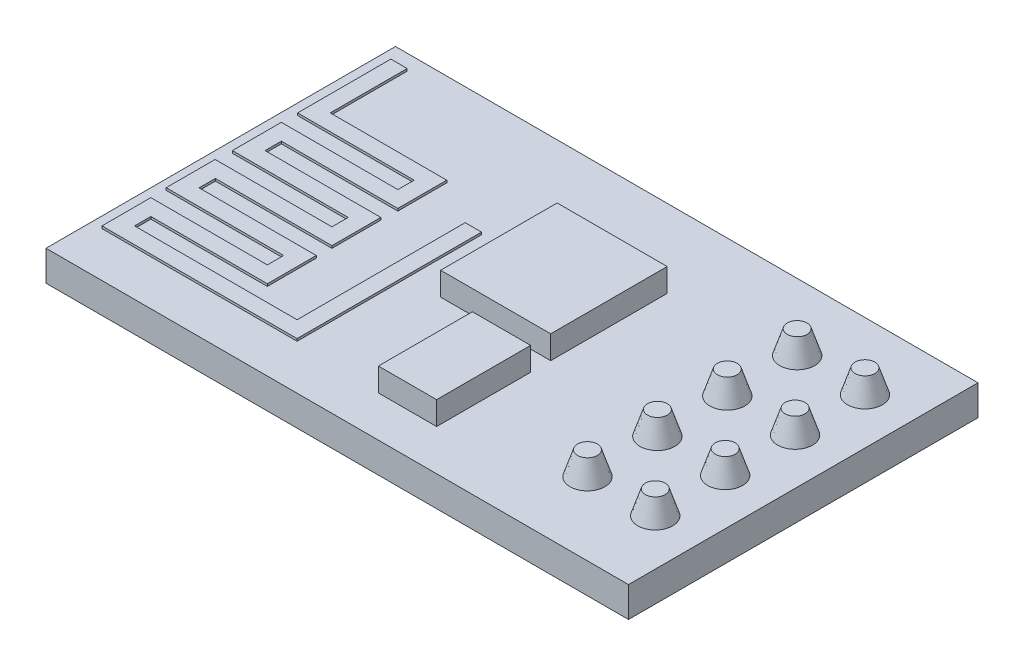
from build123d import *

# Parameters (mm, degrees)
SKETCH1_W                     = 25
SKETCH1_H                     = 15
BOSS_EXTRUDE1_DEPTH           = 1.3
BOSS_EXTRUDE2_DEPTH           = 0.1
SKETCH3_W                     = 4.723765288
SKETCH3_H                     = 5
SKETCH3_W_2                   = 2.5
SKETCH3_H_2                   = 4.03488285
BOSS_EXTRUDE3_DEPTH           = 1
SKETCH4_R                     = 0.75
BOSS_EXTRUDE4_DEPTH           = 1
BOSS_EXTRUDE4_DRAFT           = 18
BOSS_EXTRUDE4_PROFILE_2_DEPTH = 1
BOSS_EXTRUDE4_PROFILE_2_DRAFT = 18
BOSS_EXTRUDE4_PROFILE_3_DEPTH = 1
BOSS_EXTRUDE4_PROFILE_3_DRAFT = 18
BOSS_EXTRUDE4_PROFILE_4_DEPTH = 1
BOSS_EXTRUDE4_PROFILE_4_DRAFT = 18
BOSS_EXTRUDE4_PROFILE_5_DEPTH = 1
BOSS_EXTRUDE4_PROFILE_5_DRAFT = 18
BOSS_EXTRUDE4_PROFILE_6_DEPTH = 1
BOSS_EXTRUDE4_PROFILE_6_DRAFT = 18
BOSS_EXTRUDE4_PROFILE_7_DEPTH = 1
BOSS_EXTRUDE4_PROFILE_7_DRAFT = 18
BOSS_EXTRUDE4_PROFILE_8_DEPTH = 1
BOSS_EXTRUDE4_PROFILE_8_DRAFT = 18


with BuildPart() as part:
    # Sketch1 → Boss-Extrude1 (new body)
    with BuildSketch(Plane(origin=(0, 0, 0), x_dir=(1, 0, 0), z_dir=(0, 1, 0))):
        Rectangle(SKETCH1_W, SKETCH1_H)
    extrude(amount=BOSS_EXTRUDE1_DEPTH)

    # Sketch2 → Boss-Extrude2 (add)
    with BuildSketch(Plane(origin=(0, 1.3, 0), x_dir=(1, 0, 0), z_dir=(0, 1, 0))):
        Polygon((-3.654721125, -5.569339468), (-12.030839718, -5.569339468), (-12.030839718, -3.469339468), (-7.030839718, -3.469339468), (-7.030839718, -2.769339468), (-12.071748872, -2.769339468), (-12.071748872, -0.669339468), (-7.060469733, -0.669339468), (-7.060469733, 0.030660532), (-12.030839718, 0.030660532), (-12.030839718, 2.130660532), (-7.030839718, 2.130660532), (-7.030839718, 2.830660532), (-12.030839718, 2.830660532), (-12.030839718, 6.830660532), (-11.330839718, 6.830660532), (-11.330839718, 3.530660532), (-6.330839718, 3.530660532), (-6.330839718, 1.430660532), (-11.330839718, 1.430660532), (-11.330839718, 0.730660532), (-6.360469733, 0.730660532), (-6.360469733, -1.369339468), (-11.360469733, -1.369339468), (-11.360469733, -2.069339468), (-6.330839718, -2.069339468), (-6.330839718, -4.169339468), (-11.330839718, -4.169339468), (-11.330839718, -4.869339468), (-4.354721125, -4.869339468), (-4.354721125, 2.346150012), (-3.654721125, 2.346150012), align=None)
    extrude(amount=BOSS_EXTRUDE2_DEPTH)

    # Sketch3 → Boss-Extrude3 (add)
    with BuildSketch(Plane(origin=(0, 1.3, 0), x_dir=(1, 0, 0), z_dir=(0, 1, 0))):
        with Locations((0.147617665, 1.651198425)):
            Rectangle(SKETCH3_W, SKETCH3_H)
        with Locations((1.259500309, -3.727346048)):
            Rectangle(SKETCH3_W_2, SKETCH3_H_2)
    extrude(amount=BOSS_EXTRUDE3_DEPTH)


with BuildPart() as boss_extrude4_tool:
    # Sketch4 → Boss-Extrude4 (with draft: the straight prism first)
    with BuildSketch(Plane(origin=(0, 1.3, 0), x_dir=(1, 0, 0), z_dir=(0, 1, 0))):
        with Locations((7.608740396, 4.631238018)):
            Circle(SKETCH4_R)
    extrude(amount=BOSS_EXTRUDE4_DEPTH)
    # Boss-Extrude4: the draft: its side faces are tilted about the plane it starts from
    boss_extrude4_sides = [boss_extrude4_tool.faces().sort_by_distance(p)[0] for p in [
        (6.858740396, 1.8, -4.631238018),
    ]]
    draft(boss_extrude4_sides, Plane(origin=(0, 1.3, 0), x_dir=(1, 0, 0), z_dir=(0, 1, 0)), BOSS_EXTRUDE4_DRAFT)


with BuildPart() as part_1:
    add(part.part)

    # Boss-Extrude4: add boss_extrude4_tool
    add(boss_extrude4_tool.part)


with BuildPart() as boss_extrude4_profile_2_tool:
    # Sketch4 → Boss-Extrude4 profile 2 (with draft: the straight prism first)
    with BuildSketch(Plane(origin=(0, 1.3, 0), x_dir=(1, 0, 0), z_dir=(0, 1, 0))):
        with Locations((10.517617168, 4.631238018)):
            Circle(SKETCH4_R)
    extrude(amount=BOSS_EXTRUDE4_PROFILE_2_DEPTH)
    # Boss-Extrude4 profile 2: the draft: its side faces are tilted about the plane it starts from
    boss_extrude4_profile_2_sides = [boss_extrude4_profile_2_tool.faces().sort_by_distance(p)[0] for p in [
        (9.767617168, 1.8, -4.631238018),
    ]]
    draft(boss_extrude4_profile_2_sides, Plane(origin=(0, 1.3, 0), x_dir=(1, 0, 0), z_dir=(0, 1, 0)), BOSS_EXTRUDE4_PROFILE_2_DRAFT)


with BuildPart() as part_2:
    add(part_1.part)

    # Boss-Extrude4 profile 2: add boss_extrude4_profile_2_tool
    add(boss_extrude4_profile_2_tool.part)


with BuildPart() as boss_extrude4_profile_3_tool:
    # Sketch4 → Boss-Extrude4 profile 3 (with draft: the straight prism first)
    with BuildSketch(Plane(origin=(0, 1.3, 0), x_dir=(1, 0, 0), z_dir=(0, 1, 0))):
        with Locations((7.608740396, 1.631238018)):
            Circle(SKETCH4_R)
    extrude(amount=BOSS_EXTRUDE4_PROFILE_3_DEPTH)
    # Boss-Extrude4 profile 3: the draft: its side faces are tilted about the plane it starts from
    boss_extrude4_profile_3_sides = [boss_extrude4_profile_3_tool.faces().sort_by_distance(p)[0] for p in [
        (6.858740396, 1.8, -1.631238018),
    ]]
    draft(boss_extrude4_profile_3_sides, Plane(origin=(0, 1.3, 0), x_dir=(1, 0, 0), z_dir=(0, 1, 0)), BOSS_EXTRUDE4_PROFILE_3_DRAFT)


with BuildPart() as part_3:
    add(part_2.part)

    # Boss-Extrude4 profile 3: add boss_extrude4_profile_3_tool
    add(boss_extrude4_profile_3_tool.part)


with BuildPart() as boss_extrude4_profile_4_tool:
    # Sketch4 → Boss-Extrude4 profile 4 (with draft: the straight prism first)
    with BuildSketch(Plane(origin=(0, 1.3, 0), x_dir=(1, 0, 0), z_dir=(0, 1, 0))):
        with Locations((10.517617168, 1.631238018)):
            Circle(SKETCH4_R)
    extrude(amount=BOSS_EXTRUDE4_PROFILE_4_DEPTH)
    # Boss-Extrude4 profile 4: the draft: its side faces are tilted about the plane it starts from
    boss_extrude4_profile_4_sides = [boss_extrude4_profile_4_tool.faces().sort_by_distance(p)[0] for p in [
        (9.767617168, 1.8, -1.631238018),
    ]]
    draft(boss_extrude4_profile_4_sides, Plane(origin=(0, 1.3, 0), x_dir=(1, 0, 0), z_dir=(0, 1, 0)), BOSS_EXTRUDE4_PROFILE_4_DRAFT)


with BuildPart() as part_4:
    add(part_3.part)

    # Boss-Extrude4 profile 4: add boss_extrude4_profile_4_tool
    add(boss_extrude4_profile_4_tool.part)


with BuildPart() as boss_extrude4_profile_5_tool:
    # Sketch4 → Boss-Extrude4 profile 5 (with draft: the straight prism first)
    with BuildSketch(Plane(origin=(0, 1.3, 0), x_dir=(1, 0, 0), z_dir=(0, 1, 0))):
        with Locations((7.608740396, -1.368761982)):
            Circle(SKETCH4_R)
    extrude(amount=BOSS_EXTRUDE4_PROFILE_5_DEPTH)
    # Boss-Extrude4 profile 5: the draft: its side faces are tilted about the plane it starts from
    boss_extrude4_profile_5_sides = [boss_extrude4_profile_5_tool.faces().sort_by_distance(p)[0] for p in [
        (6.858740396, 1.8, 1.368761982),
    ]]
    draft(boss_extrude4_profile_5_sides, Plane(origin=(0, 1.3, 0), x_dir=(1, 0, 0), z_dir=(0, 1, 0)), BOSS_EXTRUDE4_PROFILE_5_DRAFT)


with BuildPart() as part_5:
    add(part_4.part)

    # Boss-Extrude4 profile 5: add boss_extrude4_profile_5_tool
    add(boss_extrude4_profile_5_tool.part)


with BuildPart() as boss_extrude4_profile_6_tool:
    # Sketch4 → Boss-Extrude4 profile 6 (with draft: the straight prism first)
    with BuildSketch(Plane(origin=(0, 1.3, 0), x_dir=(1, 0, 0), z_dir=(0, 1, 0))):
        with Locations((10.517617168, -1.368761982)):
            Circle(SKETCH4_R)
    extrude(amount=BOSS_EXTRUDE4_PROFILE_6_DEPTH)
    # Boss-Extrude4 profile 6: the draft: its side faces are tilted about the plane it starts from
    boss_extrude4_profile_6_sides = [boss_extrude4_profile_6_tool.faces().sort_by_distance(p)[0] for p in [
        (9.767617168, 1.8, 1.368761982),
    ]]
    draft(boss_extrude4_profile_6_sides, Plane(origin=(0, 1.3, 0), x_dir=(1, 0, 0), z_dir=(0, 1, 0)), BOSS_EXTRUDE4_PROFILE_6_DRAFT)


with BuildPart() as part_6:
    add(part_5.part)

    # Boss-Extrude4 profile 6: add boss_extrude4_profile_6_tool
    add(boss_extrude4_profile_6_tool.part)


with BuildPart() as boss_extrude4_profile_7_tool:
    # Sketch4 → Boss-Extrude4 profile 7 (with draft: the straight prism first)
    with BuildSketch(Plane(origin=(0, 1.3, 0), x_dir=(1, 0, 0), z_dir=(0, 1, 0))):
        with Locations((7.608740396, -4.368761982)):
            Circle(SKETCH4_R)
    extrude(amount=BOSS_EXTRUDE4_PROFILE_7_DEPTH)
    # Boss-Extrude4 profile 7: the draft: its side faces are tilted about the plane it starts from
    boss_extrude4_profile_7_sides = [boss_extrude4_profile_7_tool.faces().sort_by_distance(p)[0] for p in [
        (6.858740396, 1.8, 4.368761982),
    ]]
    draft(boss_extrude4_profile_7_sides, Plane(origin=(0, 1.3, 0), x_dir=(1, 0, 0), z_dir=(0, 1, 0)), BOSS_EXTRUDE4_PROFILE_7_DRAFT)


with BuildPart() as part_7:
    add(part_6.part)

    # Boss-Extrude4 profile 7: add boss_extrude4_profile_7_tool
    add(boss_extrude4_profile_7_tool.part)


with BuildPart() as boss_extrude4_profile_8_tool:
    # Sketch4 → Boss-Extrude4 profile 8 (with draft: the straight prism first)
    with BuildSketch(Plane(origin=(0, 1.3, 0), x_dir=(1, 0, 0), z_dir=(0, 1, 0))):
        with Locations((10.517617168, -4.368761982)):
            Circle(SKETCH4_R)
    extrude(amount=BOSS_EXTRUDE4_PROFILE_8_DEPTH)
    # Boss-Extrude4 profile 8: the draft: its side faces are tilted about the plane it starts from
    boss_extrude4_profile_8_sides = [boss_extrude4_profile_8_tool.faces().sort_by_distance(p)[0] for p in [
        (9.767617168, 1.8, 4.368761982),
    ]]
    draft(boss_extrude4_profile_8_sides, Plane(origin=(0, 1.3, 0), x_dir=(1, 0, 0), z_dir=(0, 1, 0)), BOSS_EXTRUDE4_PROFILE_8_DRAFT)


with BuildPart() as part_8:
    add(part_7.part)

    # Boss-Extrude4 profile 8: add boss_extrude4_profile_8_tool
    add(boss_extrude4_profile_8_tool.part)


solid = part_8.part
